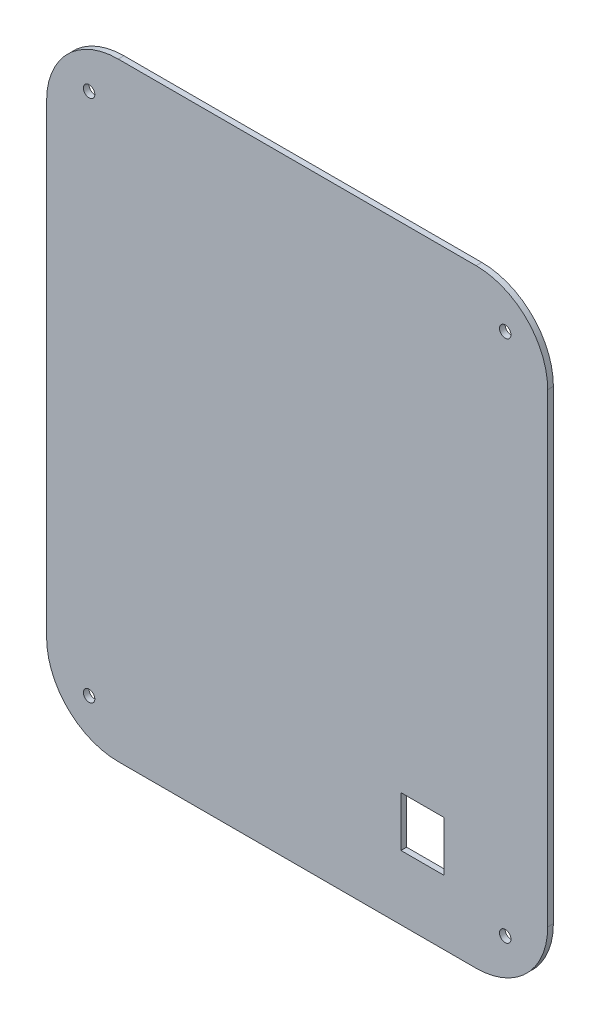
from build123d import *

# Parameters (mm, degrees)
SKETCH1_R           = 1.6
BOSS_EXTRUDE1_DEPTH = 1.5875
SKETCH3_W           = 12
SKETCH3_H           = 14
CUT_EXTRUDE1_DEPTH  = 125.589614038


with BuildPart() as part:
    # Sketch1 → Boss-Extrude1 (new body)
    with BuildSketch(Plane.XY):
        with BuildLine():
            Line((52.877308189, 101.03934739), (-47.122691811, 101.03934739))
            ThreePointArc((-47.122691811, 101.03934739), (-61.264827435, 95.181483014), (-67.122691811, 81.03934739))
            Line((-67.122691811, 81.03934739), (-67.122691811, -48.96065261))
            ThreePointArc((-67.122691811, -48.96065261), (-61.264827435, -63.102788233), (-47.122691811, -68.96065261))
            Line((-47.122691811, -68.96065261), (52.877308189, -68.96065261))
            ThreePointArc((52.877308189, -68.96065261), (67.019443812, -63.102788233), (72.877308189, -48.96065261))
            Line((72.877308189, -48.96065261), (72.877308189, 81.03934739))
            ThreePointArc((72.877308189, 81.03934739), (67.019443812, 95.181483014), (52.877308189, 101.03934739))
        make_face()
        with Locations((-55.254419795, -57.092380593)):
            Circle(SKETCH1_R, mode=Mode.SUBTRACT)
        with Locations((61.009036172, -57.092380593)):
            Circle(SKETCH1_R, mode=Mode.SUBTRACT)
        with Locations((61.009036172, 89.171075374)):
            Circle(SKETCH1_R, mode=Mode.SUBTRACT)
        with Locations((-55.254419795, 89.171075374)):
            Circle(SKETCH1_R, mode=Mode.SUBTRACT)
    extrude(amount=BOSS_EXTRUDE1_DEPTH)

    # Sketch3 → Cut-Extrude1 (cut, through all)
    with BuildSketch(Plane.XY.offset(1.5875)):
        with Locations((37.877308189, -43.96065261)):
            Rectangle(SKETCH3_W, SKETCH3_H)
    extrude(amount=-CUT_EXTRUDE1_DEPTH, mode=Mode.SUBTRACT)


solid = part.part
